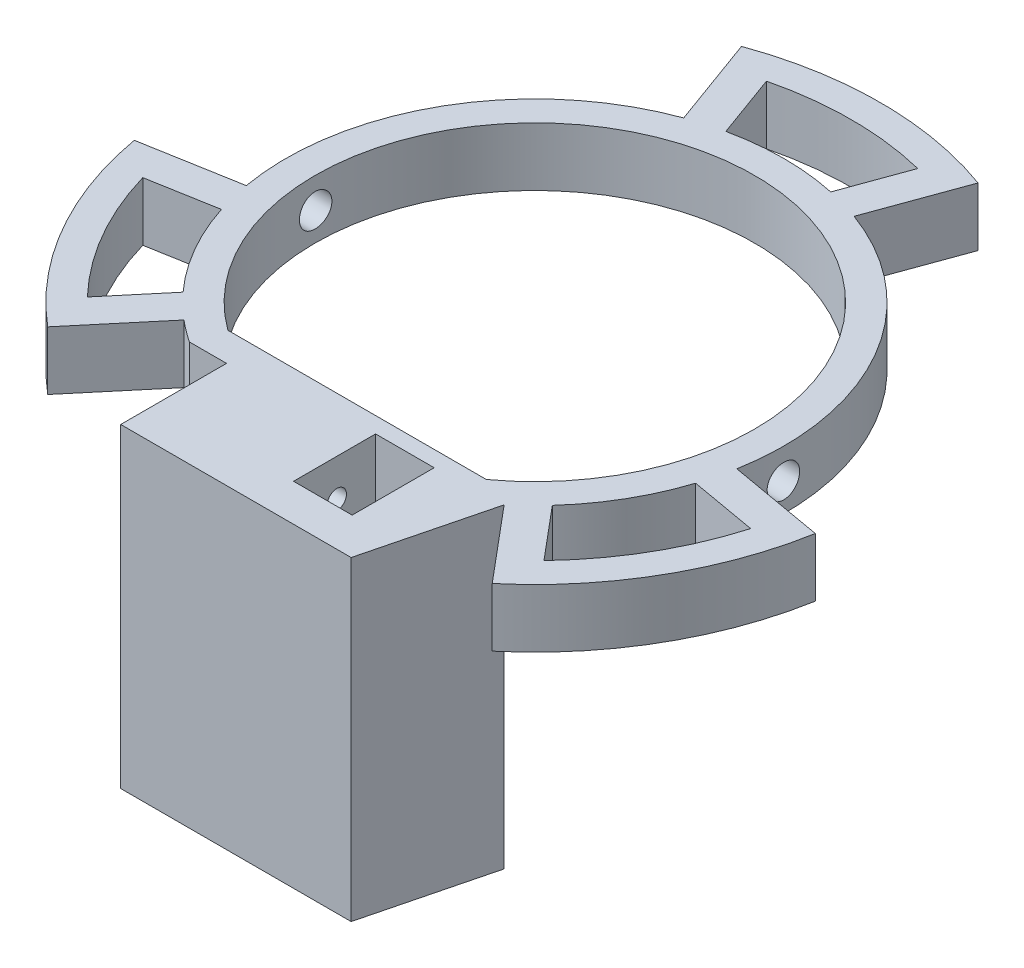
from build123d import *

# Parameters (mm, degrees)
SKETCH1_R               = 23.8125
BOSS_EXTRUDE1_DEPTH     = 6.35
CUT_EXTRUDE1_DEPTH      = 53.964614985
CUT_EXTRUDE1_DEPTH_BACK = 53.964614985
SKETCH4_R               = 1.75768
BOSS_EXTRUDE3_START     = -6.35
BOSS_EXTRUDE3_DEPTH     = 6.35
SKETCH13_W              = 24.51582
SKETCH13_H              = 34.16660521
BOSS_EXTRUDE7_DEPTH     = 2.2225
SKETCH14_W              = 18.4
SKETCH14_H              = 4.571
BOSS_EXTRUDE8_DEPTH     = 12.423266239
SKETCH19_W              = 1.60782
SKETCH19_H              = 34.16660521
BOSS_EXTRUDE14_DEPTH    = 12.423266239
SKETCH20_W              = 14.645766239
SKETCH20_H              = 34.16660521
BOSS_EXTRUDE15_DEPTH    = 0.455043
CUT_EXTRUDE2_DEPTH      = 4.8895
SKETCH25_W              = 11.467193476
SKETCH25_H              = 6.35
CUT_EXTRUDE3_DEPTH      = 4.7625
SKETCH23_R              = 1.0414
CUT_EXTRUDE4_DEPTH      = 17.78
SKETCH27_R              = 1.0414
CUT_EXTRUDE5_DEPTH      = 12.7
BOSS_EXTRUDE17_START    = -34.16660521
BOSS_EXTRUDE17_DEPTH    = 34.16660521
SKETCH31_W              = 6.35
SKETCH31_H              = 8.89
CUT_EXTRUDE6_DEPTH      = 7.874


with BuildPart() as part:
    # Sketch1 → Boss-Extrude1 (new body)
    with BuildSketch(Plane(origin=(0, 0, 0), x_dir=(1, 0, 0), z_dir=(0, 1, 0))):
        with BuildLine():
            Line((-26.577499234, -4.686330195), (-36.895822467, -6.505728976))
            ThreePointArc((-36.895822467, -6.505728976), (-32.445641753, -18.7325), (-24.082037797, -28.699855061))
            Line((-24.082037797, -28.699855061), (-17.347230616, -20.673624409))
            ThreePointArc((-17.347230616, -20.673624409), (0, -26.9875), (17.347230616, -20.673624409))
            Line((17.347230616, -20.673624409), (24.082037797, -28.699855061))
            ThreePointArc((24.082037797, -28.699855061), (32.445641753, -18.7325), (36.895822467, -6.505728976))
            Line((36.895822467, -6.505728976), (26.577499234, -4.686330195))
            ThreePointArc((26.577499234, -4.686330195), (23.371860585, 13.49375), (9.230268618, 25.359954603))
            Line((9.230268618, 25.359954603), (12.81378467, 35.205584038))
            ThreePointArc((12.81378467, 35.205584038), (0, 37.465), (-12.81378467, 35.205584038))
            Line((-12.81378467, 35.205584038), (-9.230268618, 25.359954603))
            ThreePointArc((-9.230268618, 25.359954603), (-22.106865795, 15.479394076), (-26.9875, 0))
            ThreePointArc((-26.9875, 0), (-26.884804415, -2.352115607), (-26.577499234, -4.686330195))
        make_face()
        with BuildLine():
            ThreePointArc((20.006273745, -18.112817756), (23.371860585, -13.49375), (25.689297184, -8.269532421))
            Line((25.689297184, -8.269532421), (32.934160714, -9.546997332))
            ThreePointArc((32.934160714, -9.546997332), (29.696011096, -17.145), (24.735022577, -23.748321164))
            Line((24.735022577, -23.748321164), (20.006273745, -18.112817756))
        make_face(mode=Mode.SUBTRACT)
        with BuildLine():
            Line((-32.934160714, -9.546997332), (-25.689297184, -8.269532421))
            ThreePointArc((-25.689297184, -8.269532421), (-23.371860585, -13.49375), (-20.006273745, -18.112817756))
            Line((-20.006273745, -18.112817756), (-24.735022577, -23.748321164))
            ThreePointArc((-24.735022577, -23.748321164), (-29.696011096, -17.145), (-32.934160714, -9.546997332))
        make_face(mode=Mode.SUBTRACT)
        with Locations(Location((0, 0, 0), (0, 0, 270))):
            Circle(SKETCH1_R, mode=Mode.SUBTRACT)
        with BuildLine():
            ThreePointArc((-8.199138137, 33.295318497), (0, 34.29), (8.199138137, 33.295318497))
            Line((8.199138137, 33.295318497), (5.683023438, 26.382350177))
            ThreePointArc((5.683023438, 26.382350177), (0, 26.9875), (-5.683023438, 26.382350177))
            Line((-5.683023438, 26.382350177), (-8.199138137, 33.295318497))
        make_face(mode=Mode.SUBTRACT)
    extrude(amount=BOSS_EXTRUDE1_DEPTH)

    # Sketch4 → Cut-Extrude1 (cut, two sides: drawn at the far end of the back side and taken through both)
    with BuildSketch(Plane(origin=(0, 0, 0), x_dir=(0, 0, -1), z_dir=(1, 0, 0)).offset(-CUT_EXTRUDE1_DEPTH_BACK)):
        with Locations((0, 3.071710122)):
            Circle(SKETCH4_R)
    extrude(amount=CUT_EXTRUDE1_DEPTH + CUT_EXTRUDE1_DEPTH_BACK, mode=Mode.SUBTRACT)

    # Sketch7 → Boss-Extrude3 (add)
    with BuildSketch(Plane(origin=(0, 6.35, 0), x_dir=(1, 0, 0), z_dir=(0, 1, 0)).offset(BOSS_EXTRUDE3_START)):
        with BuildLine():
            Line((11.940053077, -31.683419289), (11.940053077, -24.202485177))
            ThreePointArc((11.940053077, -24.202485177), (0.536822134, -26.98216037), (-10.967946923, -24.658250071))
            Line((-10.967946923, -24.658250071), (-10.967946923, -31.683419289))
            Line((-10.967946923, -31.683419289), (11.940053077, -31.683419289))
        make_face()
        with BuildLine():
            ThreePointArc((-14.002916152, -19.26015305), (0, -23.8125), (14.002916152, -19.26015305))
            Line((14.002916152, -19.26015305), (-14.002916152, -19.26015305))
        make_face()
    extrude(amount=BOSS_EXTRUDE3_DEPTH)

    # Sketch13 → Boss-Extrude7 (add)
    with BuildSketch(Plane.XY.offset(31.683419289)):
        with Locations((1.289963077, -10.733302605)):
            Rectangle(SKETCH13_W, SKETCH13_H)
    extrude(amount=BOSS_EXTRUDE7_DEPTH)

    # Sketch14 → Boss-Extrude8 (add)
    with BuildSketch(Plane(origin=(0, 0, 31.683419289), x_dir=(-1, 0, 0), z_dir=(0, 0, -1))):
        with Locations((-2.740053077, -25.53110521)):
            Rectangle(SKETCH14_W, SKETCH14_H)
    extrude(amount=BOSS_EXTRUDE8_DEPTH)

    # Sketch19 → Boss-Extrude14 (add)
    with BuildSketch(Plane(origin=(0, 0, 31.683419289), x_dir=(-1, 0, 0), z_dir=(0, 0, -1))):
        with Locations((-12.743963077, -10.733302605)):
            Rectangle(SKETCH19_W, SKETCH19_H)
    extrude(amount=BOSS_EXTRUDE14_DEPTH)

    # Sketch20 → Boss-Extrude15 (add)
    with BuildSketch(Plane(origin=(13.547873077, 0, 0), x_dir=(0, 0, -1), z_dir=(1, 0, 0))):
        with Locations((-26.58303617, -10.733302605)):
            Rectangle(SKETCH20_W, SKETCH20_H)
    extrude(amount=BOSS_EXTRUDE15_DEPTH)

    # Sketch21 → Cut-Extrude2 (cut)
    with BuildSketch(Plane.XZ):
        Polygon((-6.459946923, 19.26015305), (-6.459946923, 30.299813914), (-6.459946923, 31.683419289), (-9.467946923, 31.683419289), (-9.467946923, 30.629419289), (-9.467946923, 19.26015305), align=None)
    extrude(amount=-CUT_EXTRUDE2_DEPTH, mode=Mode.SUBTRACT)

    # Sketch25 → Cut-Extrude3 (cut)
    with BuildSketch(Plane.ZY.offset(10.967946923)):
        with Locations((28.172322551, 3.175)):
            Rectangle(SKETCH25_W, SKETCH25_H)
    extrude(amount=CUT_EXTRUDE3_DEPTH, mode=Mode.SUBTRACT)

    # Sketch23 → Cut-Extrude4 (cut)
    with BuildSketch(Plane.ZY.offset(10.967946923)):
        with Locations((25.179419289, 2.28739479)):
            Circle(SKETCH23_R)
    extrude(amount=-CUT_EXTRUDE4_DEPTH, mode=Mode.SUBTRACT)

    # Sketch27 → Cut-Extrude5 (cut)
    with BuildSketch(Plane.ZY.offset(6.459946923)):
        with Locations((25.179419289, -25.21260521)):
            Circle(SKETCH27_R)
    extrude(amount=-CUT_EXTRUDE5_DEPTH, mode=Mode.SUBTRACT)

    # Sketch29 → Boss-Extrude17 (add)
    with BuildSketch(Plane(origin=(0, 6.35, 0), x_dir=(1, 0, 0), z_dir=(0, 1, 0)).offset(BOSS_EXTRUDE17_START)):
        with BuildLine():
            Line((17.347230616, -20.673624409), (14.002916152, -19.26015305))
            Line((14.002916152, -19.26015305), (14.002916152, -20.673624409))
            Line((14.002916152, -20.673624409), (14.002916152, -20.706319513))
            Line((14.002916152, -20.706319513), (14.002916152, -23.07040302))
            ThreePointArc((14.002916152, -23.07040302), (15.720816217, -21.935840392), (17.347230616, -20.673624409))
        make_face()
        with BuildLine():
            Line((17.347230616, -20.673624409), (14.002916152, -33.905919289))
            Line((14.002916152, -33.905919289), (14.002916152, -23.07040302))
            ThreePointArc((14.002916152, -23.07040302), (15.720816217, -21.935840392), (17.347230616, -20.673624409))
        make_face()
    extrude(amount=BOSS_EXTRUDE17_DEPTH)

    # Sketch31 → Cut-Extrude6 (cut)
    with BuildSketch(Plane(origin=(0, 6.35, 0), x_dir=(1, 0, 0), z_dir=(0, 1, 0))):
        with Locations((6.901888069, -25.428029678)):
            Rectangle(SKETCH31_W, SKETCH31_H)
    extrude(amount=-CUT_EXTRUDE6_DEPTH, mode=Mode.SUBTRACT)


solid = part.part
